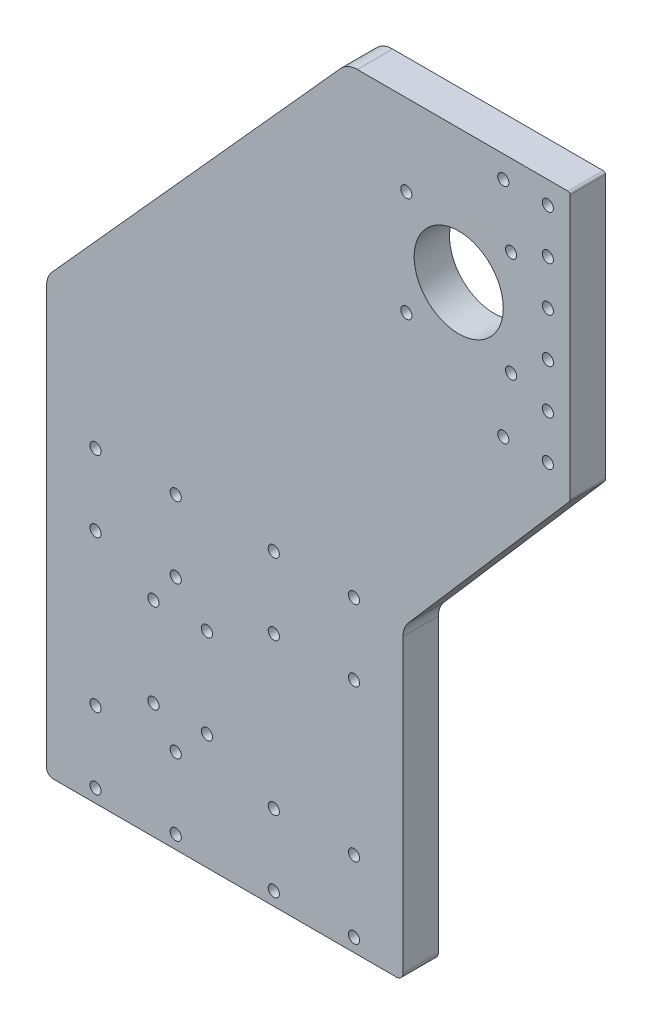
from build123d import *

# Parameters (mm, degrees)
SKETCH1_W           = 160
SKETCH1_H           = 144
SKETCH1_R           = 2.5
BOSS_EXTRUDE1_DEPTH = 15.875
BOSS_EXTRUDE2_DEPTH = 15.875
BOSS_EXTRUDE3_DEPTH = 15.875
FILLET2_R           = 10
SKETCH4_R           = 2.5
CUT_EXTRUDE1_DEPTH  = 314.466131544
FILLET3_R           = 1
SKETCH5_R           = 2.5
CUT_EXTRUDE2_DEPTH  = 314.466131544
FILLET4_R           = 2
SKETCH6_R           = 20
SKETCH6_R_2         = 2.5
CUT_EXTRUDE3_DEPTH  = 314.466131544
FILLET5_R           = 3


with BuildPart() as part:
    # Sketch1 → Boss-Extrude1 (new body)
    with BuildSketch(Plane.XY):
        Rectangle(SKETCH1_W, SKETCH1_H)
        with Locations((-58, -66)):
            Circle(SKETCH1_R, mode=Mode.SUBTRACT)
        with Locations((-22, -66)):
            Circle(SKETCH1_R, mode=Mode.SUBTRACT)
        with Locations((-58, -34)):
            Circle(SKETCH1_R, mode=Mode.SUBTRACT)
        with Locations((-22, -34)):
            Circle(SKETCH1_R, mode=Mode.SUBTRACT)
        with Locations(Location((58, -66, 0), (0, 0, 180))):
            Circle(SKETCH1_R, mode=Mode.SUBTRACT)
        with Locations(Location((22, -66, 0), (0, 0, 180))):
            Circle(SKETCH1_R, mode=Mode.SUBTRACT)
        with Locations(Location((22, -34, 0), (0, 0, 180))):
            Circle(SKETCH1_R, mode=Mode.SUBTRACT)
        with Locations(Location((58, -34, 0), (0, 0, 180))):
            Circle(SKETCH1_R, mode=Mode.SUBTRACT)
        with Locations(Location((-58, 66, 0), (0, 0, 180))):
            Circle(SKETCH1_R, mode=Mode.SUBTRACT)
        with Locations(Location((-22, 66, 0), (0, 0, 180))):
            Circle(SKETCH1_R, mode=Mode.SUBTRACT)
        with Locations((22, 66)):
            Circle(SKETCH1_R, mode=Mode.SUBTRACT)
        with Locations((58, 66)):
            Circle(SKETCH1_R, mode=Mode.SUBTRACT)
        with Locations((58, 34)):
            Circle(SKETCH1_R, mode=Mode.SUBTRACT)
        with Locations((22, 34)):
            Circle(SKETCH1_R, mode=Mode.SUBTRACT)
        with Locations(Location((-22, 34, 0), (0, 0, 180))):
            Circle(SKETCH1_R, mode=Mode.SUBTRACT)
        with Locations(Location((-58, 34, 0), (0, 0, 180))):
            Circle(SKETCH1_R, mode=Mode.SUBTRACT)
    extrude(amount=BOSS_EXTRUDE1_DEPTH)

    # Sketch2 → Boss-Extrude2 (add, through all)
    with BuildSketch(Plane.XY.offset(15.875)):
        Polygon((55, 272), (155, 272), (155, 152), (80, 152), (80, 72), (-80, 72), (-80, 122), align=None)
    extrude(amount=-BOSS_EXTRUDE2_DEPTH)

    # Sketch3 → Boss-Extrude3 (add, through all)
    with BuildSketch(Plane.XY.offset(15.875)):
        Polygon((155, 152), (80, 65.589776693), (80, 152), align=None)
    extrude(amount=-BOSS_EXTRUDE3_DEPTH)

    # Fillet2
    fillet2_edges = [part.edges().sort_by_distance(p)[0] for p in [
        (80, 65.589776693, 7.9375),
        (-80, 122, 7.9375),
        (55, 272, 7.9375),
    ]]
    fillet(fillet2_edges, radius=FILLET2_R)

    # Sketch4 → Cut-Extrude1 (cut, through all)
    with BuildSketch(Plane.XY.offset(15.875)):
        with Locations((-32, 20)):
            Circle(SKETCH4_R)
        with Locations(Location((-8, 20, 0), (0, 0, 180))):
            Circle(SKETCH4_R)
        with Locations((-8, -20)):
            Circle(SKETCH4_R)
        with Locations(Location((-32, -20, 0), (0, 0, 180))):
            Circle(SKETCH4_R)
    extrude(amount=-CUT_EXTRUDE1_DEPTH, mode=Mode.SUBTRACT)

    # Fillet3
    fillet3_edges = [part.edges().sort_by_distance(p)[0] for p in [
        (155, 272, 7.9375),
    ]]
    fillet(fillet3_edges, radius=FILLET3_R)

    # Sketch5 → Cut-Extrude2 (cut, through all)
    with BuildSketch(Plane.XY.offset(15.875)):
        with Locations((145, 262)):
            Circle(SKETCH5_R)
        with Locations((145, 242)):
            Circle(SKETCH5_R)
        with Locations((145, 222)):
            Circle(SKETCH5_R)
        with Locations((145, 202)):
            Circle(SKETCH5_R)
        with Locations((145, 182)):
            Circle(SKETCH5_R)
        with Locations((145, 162)):
            Circle(SKETCH5_R)
        with Locations((125, 162)):
            Circle(SKETCH5_R)
        with Locations((125, 262)):
            Circle(SKETCH5_R)
    extrude(amount=-CUT_EXTRUDE2_DEPTH, mode=Mode.SUBTRACT)

    # Fillet4
    fillet4_edges = [part.edges().sort_by_distance(p)[0] for p in [
        (155, 152, 7.9375),
    ]]
    fillet(fillet4_edges, radius=FILLET4_R)

    # Sketch6 → Cut-Extrude3 (cut, through all)
    with BuildSketch(Plane.XY.offset(15.875)):
        with Locations((105, 212)):
            Circle(SKETCH6_R)
        with Locations((81.5, 235.5)):
            Circle(SKETCH6_R_2)
        with Locations((128.5, 235.5)):
            Circle(SKETCH6_R_2)
        with Locations((128.5, 188.5)):
            Circle(SKETCH6_R_2)
        with Locations((81.5, 188.5)):
            Circle(SKETCH6_R_2)
    extrude(amount=-CUT_EXTRUDE3_DEPTH, mode=Mode.SUBTRACT)

    # Fillet5
    fillet5_edges = [part.edges().sort_by_distance(p)[0] for p in [
        (80, -72, 7.9375),
        (-80, -72, 7.9375),
    ]]
    fillet(fillet5_edges, radius=FILLET5_R)


solid = part.part
